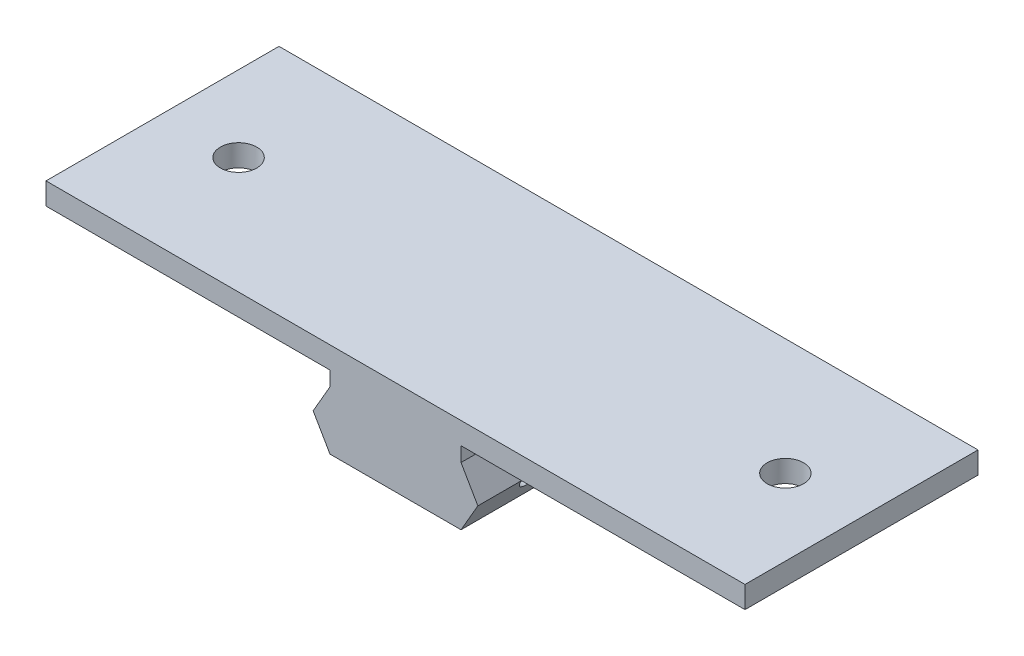
from build123d import *

# Parameters (mm, degrees)
BOSS_EXTRUDE1_DEPTH      = 32
SKETCH2_R                = 2
CUT_EXTRUDE1_DEPTH       = 35.869794274
LPATTERN1_COUNT          = 3
LPATTERN1_PITCH          = 8
BOSS_EXTRUDE2_DEPTH      = 9
BOSS_EXTRUDE2_DEPTH_BACK = 9
SKETCH3_W                = 32
SKETCH3_H                = 2
BOSS_EXTRUDE3_DEPTH      = 48
BOSS_EXTRUDE3_DEPTH_BACK = 48
SKETCH4_W                = 32
SKETCH4_H                = 3
SKETCH5_R                = 2.5
CUT_EXTRUDE2_DEPTH       = 10


with BuildPart() as part:
    # Sketch1 → Boss-Extrude1 (new body)
    with BuildSketch(Plane.XY):
        Polygon((9, 0), (-9, 0), (-11.309401077, 4), (-9, 8), (9, 8), (11.309401077, 4), align=None)
    extrude(amount=BOSS_EXTRUDE1_DEPTH)

    # Sketch2 → Cut-Extrude1 (cut, symmetric)
    with BuildSketch(Plane(origin=(0, 0, 0), x_dir=(0, 0, -1), z_dir=(1, 0, 0))):
        with Locations((-24, 4)):
            Circle(SKETCH2_R)
    cut_extrude1 = extrude(amount=CUT_EXTRUDE1_DEPTH, both=True, mode=Mode.SUBTRACT)

    # LPattern1: Cut-Extrude1 ×3
    with Locations(*[(0, 0, -i * LPATTERN1_PITCH) for i in range(1, LPATTERN1_COUNT)]):
        add(cut_extrude1, mode=Mode.SUBTRACT)

    # Sketch3 → Boss-Extrude2 (add, two sides: drawn at the far end of the back side and taken through both)
    with BuildSketch(Plane(origin=(0, 0, 0), x_dir=(0, 0, -1), z_dir=(1, 0, 0)).offset(-BOSS_EXTRUDE2_DEPTH_BACK)):
        with Locations((-16, 9)):
            Rectangle(SKETCH3_W, SKETCH3_H)
    extrude(amount=BOSS_EXTRUDE2_DEPTH + BOSS_EXTRUDE2_DEPTH_BACK)

    # Sketch4 → Boss-Extrude3 (add, two sides: drawn at the far end of the back side and taken through both)
    with BuildSketch(Plane(origin=(0, 0, 0), x_dir=(0, 0, -1), z_dir=(1, 0, 0)).offset(-BOSS_EXTRUDE3_DEPTH_BACK)):
        with Locations((-16, 11.5)):
            Rectangle(SKETCH4_W, SKETCH4_H)
    extrude(amount=BOSS_EXTRUDE3_DEPTH + BOSS_EXTRUDE3_DEPTH_BACK)

    # Sketch5 → Cut-Extrude2 (cut)
    with BuildSketch(Plane(origin=(0, 13, 0), x_dir=(1, 0, 0), z_dir=(0, 1, 0))):
        with Locations(Location((-37.55, -16, 0), (0, 0, 270))):
            Circle(SKETCH5_R)
        with Locations(Location((37.55, -16, 0), (0, 0, 270))):
            Circle(SKETCH5_R)
    extrude(amount=-CUT_EXTRUDE2_DEPTH, mode=Mode.SUBTRACT)


solid = part.part
